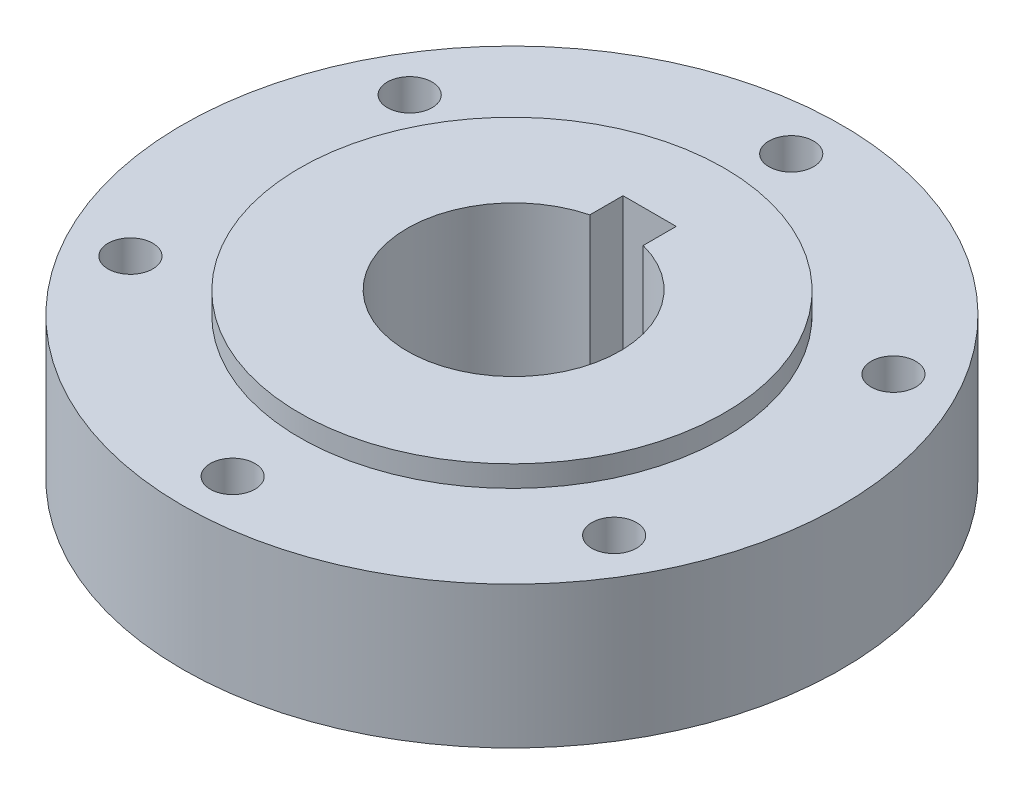
from build123d import *

# Parameters (mm, degrees)
SKETCH1_R                   = 29.5
BOSS_EXTRUDE1_DEPTH         = 12.7
SKETCH2_R                   = 19
BOSS_EXTRUDE2_DEPTH         = 1.905
F_3_4_0_75_DIAMETER_HOLE1_D = 19.05
CUT_EXTRUDE1_DEPTH          = 44.60951731
CUT_EXTRUDE1_DEPTH_BACK     = 44.60951731
SKETCH7_R                   = 2
SKETCH8_W                   = 4.7625
SKETCH8_H                   = 4.7625
CUT_EXTRUDE2_DEPTH          = 45.201878071


with BuildPart() as part:
    # Sketch1 → Boss-Extrude1 (new body)
    with BuildSketch(Plane(origin=(0, 0, 0), x_dir=(1, 0, 0), z_dir=(0, 1, 0))):
        with Locations(Location((0, 0, 0), (0, 0, 270))):
            Circle(SKETCH1_R)
    extrude(amount=BOSS_EXTRUDE1_DEPTH)

    # Sketch2 → Boss-Extrude2 (add)
    with BuildSketch(Plane(origin=(0, 12.7, 0), x_dir=(1, 0, 0), z_dir=(0, 1, 0))):
        with Locations(Location((0, 0, 0), (0, 0, 90))):
            Circle(SKETCH2_R)
    extrude(amount=BOSS_EXTRUDE2_DEPTH)

    # 3/4 (0.75) Diameter Hole1 (through all)
    with Locations(Plane(origin=(0.010328694, 14.605, -0.138454069), x_dir=(0, 0, 1), z_dir=(0, 1, 0))):
        with Locations((0, 0)):
            Hole(F_3_4_0_75_DIAMETER_HOLE1_D / 2)

    # Sketch7 → Cut-Extrude1 (cut, two sides: drawn at the far end of the back side and taken through both)
    with BuildSketch(Plane(origin=(0, 12.7, 0), x_dir=(1, 0, 0), z_dir=(0, 1, 0)).offset(-CUT_EXTRUDE1_DEPTH_BACK)):
        with Locations(Location((0, 25, 0), (0, 0, 270))):
            Circle(SKETCH7_R)
        with Locations(Location((21.650635095, 12.5, 0), (0, 0, 270))):
            Circle(SKETCH7_R)
        with Locations(Location((21.650635095, -12.5, 0), (0, 0, 270))):
            Circle(SKETCH7_R)
        with Locations(Location((0, -25, 0), (0, 0, 270))):
            Circle(SKETCH7_R)
        with Locations(Location((-21.650635095, -12.5, 0), (0, 0, 270))):
            Circle(SKETCH7_R)
        with Locations(Location((-21.650635095, 12.5, 0), (0, 0, 270))):
            Circle(SKETCH7_R)
    extrude(amount=CUT_EXTRUDE1_DEPTH + CUT_EXTRUDE1_DEPTH_BACK, mode=Mode.SUBTRACT)

    # Sketch8 → Cut-Extrude2 (cut, through all)
    with BuildSketch(Plane(origin=(0, 14.605, 0), x_dir=(1, 0, 0), z_dir=(0, 1, 0))):
        with Locations((0, 9.94446313)):
            Rectangle(SKETCH8_W, SKETCH8_H)
    extrude(amount=-CUT_EXTRUDE2_DEPTH, mode=Mode.SUBTRACT)


solid = part.part
